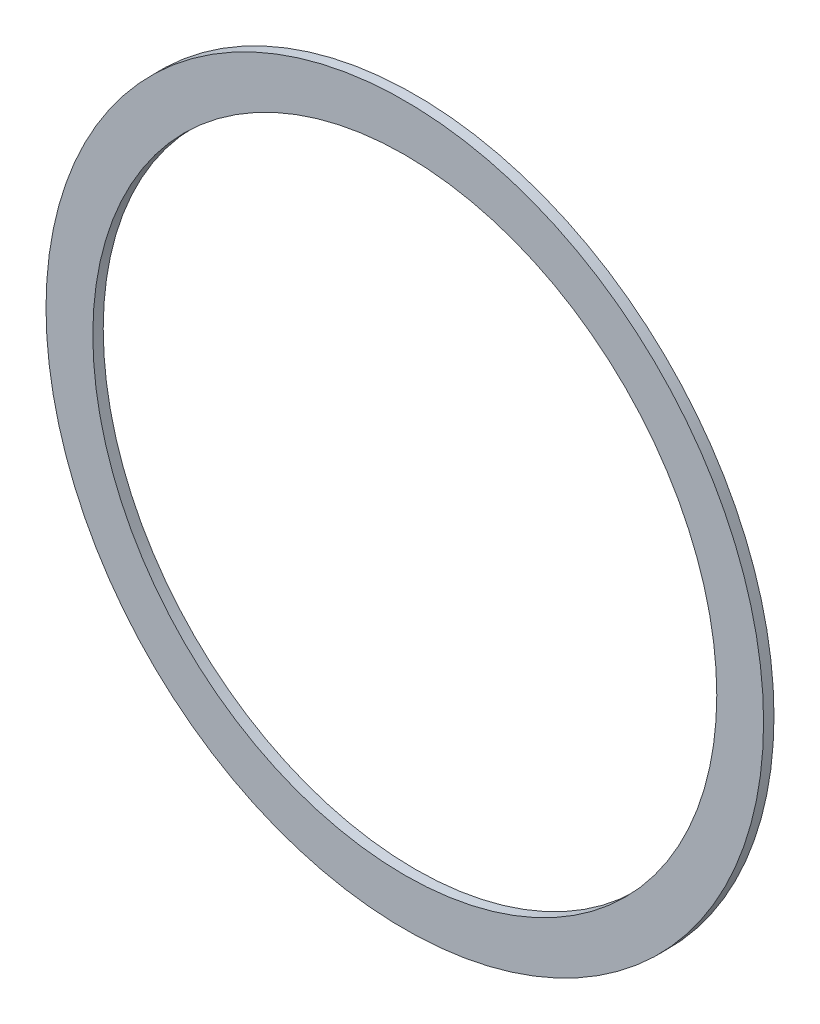
from build123d import *

# Parameters (mm, degrees)
SKETCH1_R           = 69
SKETCH1_R_2         = 60
BOSS_EXTRUDE1_DEPTH = 2


with BuildPart() as part:
    # Sketch1 → Boss-Extrude1 (new body)
    with BuildSketch(Plane.XY):
        with Locations(Location((0, 0, 0), (0, 0, 180))):
            Circle(SKETCH1_R)
        with Locations(Location((0, 0, 0), (0, 0, 180))):
            Circle(SKETCH1_R_2, mode=Mode.SUBTRACT)
    extrude(amount=BOSS_EXTRUDE1_DEPTH)


solid = part.part
